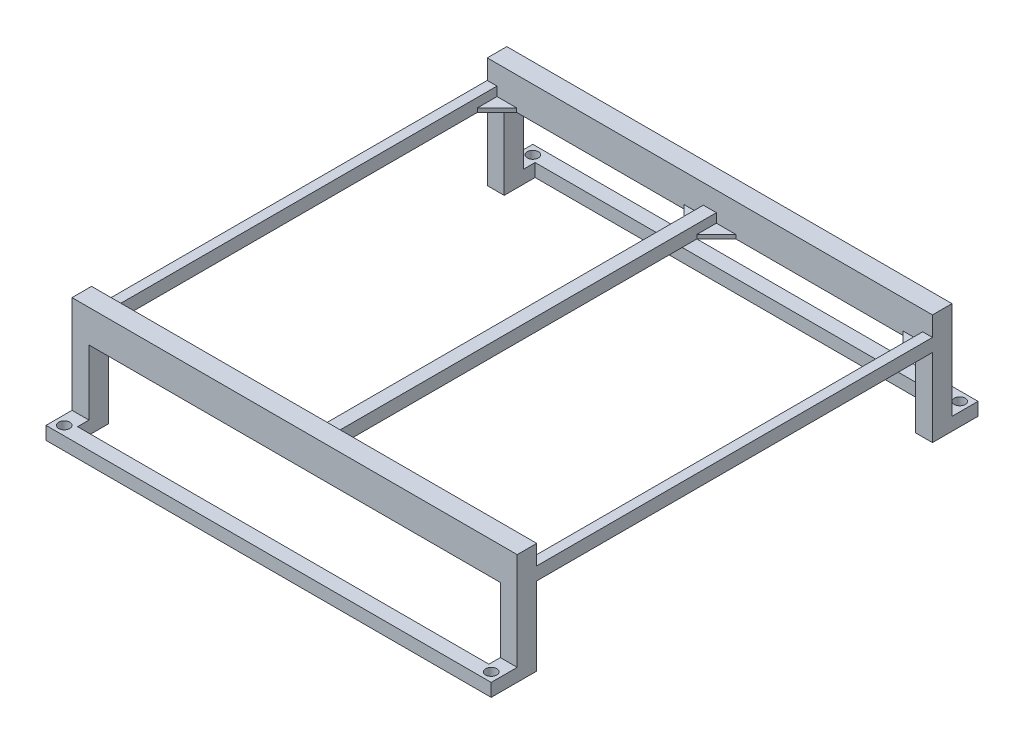
from build123d import *

# Parameters (mm, degrees)
SKETCH1_R                                = 4.25
BOSS_EXTRUDE1_DEPTH                      = 10
BOSS_EXTRUDE2_START                      = -5
BOSS_EXTRUDE2_DEPTH                      = 15
SKETCH3_W                                = 342
SKETCH3_H                                = 10
BOSS_EXTRUDE3_DEPTH                      = 304
CUT_EXTRUDE1_REACH                       = 381.323
BOSS_EXTRUDE4_DEPTH                      = 3
MIRROR5_AT_THE_SECOND_PLANE_COPY_1_DEPTH = 3


with BuildPart() as part:
    # Sketch1 → Boss-Extrude1 (new body)
    with BuildSketch(Plane(origin=(0, 0, 0), x_dir=(1, 0, 0), z_dir=(0, 1, 0))):
        Polygon((-171, 11.25), (171, 11.25), (171, 0), (171, -13.75), (158, -13.75), (158, 0), (-158, 0), (-158, -13.75), (-171, -13.75), align=None)
        with Locations(Location((-164, 4.25, 0), (0, 0, 270))):
            Circle(SKETCH1_R, mode=Mode.SUBTRACT)
        with Locations(Location((164, 4.25, 0), (0, 0, 90))):
            Circle(SKETCH1_R, mode=Mode.SUBTRACT)
    boss_extrude1 = extrude(amount=BOSS_EXTRUDE1_DEPTH)

    # Sketch2 → Boss-Extrude2 (add)
    with BuildSketch(Plane.XY.offset(13.75).offset(BOSS_EXTRUDE2_START)):
        Polygon((-171, 85), (-171, 0), (-158, 0), (-158, 60), (158, 60), (158, 0), (171, 0), (171, 85), align=None)
    boss_extrude2 = extrude(amount=BOSS_EXTRUDE2_DEPTH)

    # Sketch3 → Boss-Extrude3 (add)
    with BuildSketch(Plane.XY.offset(23.75)):
        with Locations((0, 65)):
            Rectangle(SKETCH3_W, SKETCH3_H)
    extrude(amount=BOSS_EXTRUDE3_DEPTH)

    # Sketch4 → Cut-Extrude1 (cut, up to next)
    with BuildSketch(Plane(origin=(0, 85, 0), x_dir=(1, 0, 0), z_dir=(0, 1, 0)), mode=Mode.PRIVATE) as cut_extrude1_sk1:
        Polygon((-163.5, -23.75), (-5, -23.75), (-5, -327.75), (-163.5, -327.75), (-163.5, -39.75), (-163.5, -34.75), align=None)
    cut_extrude1_tool1 = extrude(cut_extrude1_sk1.sketch, amount=-CUT_EXTRUDE1_REACH, mode=Mode.PRIVATE) & part.part
    # Sketch4 → Cut-Extrude1 (cut, up to next)
    with BuildSketch(Plane(origin=(0, 85, 0), x_dir=(1, 0, 0), z_dir=(0, 1, 0)), mode=Mode.PRIVATE) as cut_extrude1_sk2:
        Polygon((163.5, -23.75), (163.5, -51.4723011), (163.5, -327.75), (5, -327.75), (5, -39.75), (5, -23.75), align=None)
    cut_extrude1_tool2 = extrude(cut_extrude1_sk2.sketch, amount=-CUT_EXTRUDE1_REACH, mode=Mode.PRIVATE) & part.part
    add(cut_extrude1_tool1.solids().sort_by_distance((-84.25, 85, 175.75))[0], mode=Mode.SUBTRACT)
    add(cut_extrude1_tool2.solids().sort_by_distance((84.25, 85, 175.75))[0], mode=Mode.SUBTRACT)

    # Mirror3: Boss-Extrude2 across plane
    add(boss_extrude2.mirror(Plane(origin=(0, 0, 175.75), x_dir=(1, 0, 0), z_dir=(0, 0, -1))))

    # Mirror4: Boss-Extrude1 across plane
    add(boss_extrude1.mirror(Plane(origin=(0, 0, 175.75), x_dir=(1, 0, 0), z_dir=(0, 0, -1))))

    # Sketch7 → Boss-Extrude4 (add)
    with BuildSketch(Plane(origin=(0, 60, 0), x_dir=(-1, 0, 0), z_dir=(0, -1, 0))):
        Polygon((-163.5, -23.75), (-148.5, -23.75), (-163.5, -38.75), align=None)
        Polygon((-5, -23.75), (-20, -23.75), (-5, -38.75), align=None)
    boss_extrude4 = extrude(amount=-BOSS_EXTRUDE4_DEPTH)

    # Mirror5: Boss-Extrude4 across plane
    add(boss_extrude4.mirror(Plane(origin=(0, 0, 175.75), x_dir=(1, 0, 0), z_dir=(0, 0, -1))))

    # Mirror5 at the second plane: Boss-Extrude4 across plane
    add(boss_extrude4.mirror(Plane(origin=(0, 0, 0), x_dir=(0, 0, 1), z_dir=(1, 0, 0))))

    # Mirror5 at the second plane copy 1 sketc → Mirror5 at the second plane copy 1 (add)
    with BuildSketch(Plane(origin=(0, 60, 351.5), x_dir=(1, 0, 0), z_dir=(0, -1, 0))):
        Polygon((-163.5, -23.75), (-148.5, -23.75), (-163.5, -38.75), align=None)
        Polygon((-5, -23.75), (-20, -23.75), (-5, -38.75), align=None)
    extrude(amount=-MIRROR5_AT_THE_SECOND_PLANE_COPY_1_DEPTH)


solid = part.part
